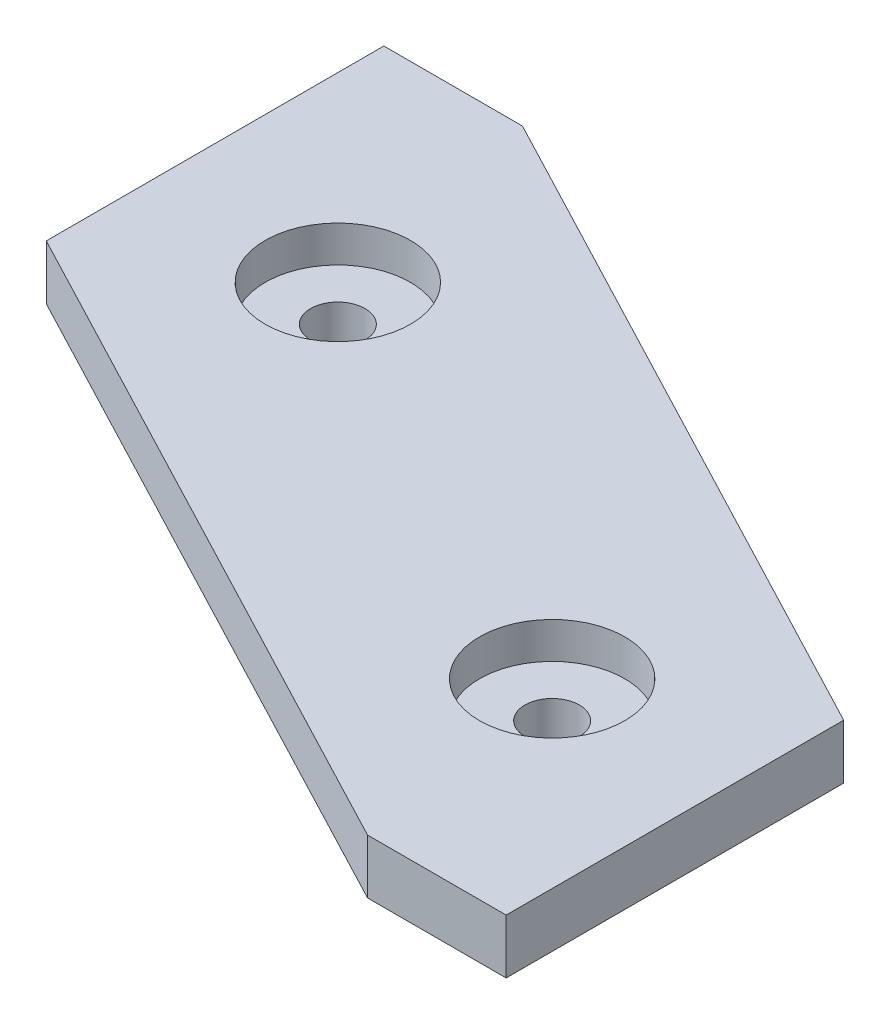
from build123d import *

# Parameters (mm, degrees)
BOSS_EXTRUDE1_DEPTH = 3
SKETCH1_R           = 6
BOSS_EXTRUDE3_DEPTH = 2
SKETCH4_R           = 1.5
CUT_EXTRUDE1_DEPTH  = 46.914811248
SKETCH5_R           = 4
CUT_EXTRUDE2_DEPTH  = 2
CUT_EXTRUDE3_DEPTH  = 46.914811248


with BuildPart() as part:
    # Sketch3 → Boss-Extrude1 (new body)
    with BuildSketch(Plane(origin=(0, 0, 0), x_dir=(1, 0, 0), z_dir=(0, 1, 0))):
        Polygon((-10, 16.53279569), (-10, -6.048583789), (34.799193535, -29.53279569), (34.799193535, -6.951416211), align=None)
    extrude(amount=BOSS_EXTRUDE1_DEPTH)

    # Sketch1 → Boss-Extrude3 (add)
    with BuildSketch(Plane(origin=(0, 0, 0), x_dir=(1, 0, 0), z_dir=(0, 1, 0))):
        with Locations(Location((0, 0, 0), (0, 0, 270))):
            Circle(SKETCH1_R)
        with Locations(Location((24.799193535, -13, 0), (0, 0, 270))):
            Circle(SKETCH1_R)
    extrude(amount=-BOSS_EXTRUDE3_DEPTH)

    # Sketch4 → Cut-Extrude1 (cut, through all)
    with BuildSketch(Plane(origin=(0, 3, 0), x_dir=(1, 0, 0), z_dir=(0, 1, 0))):
        with Locations(Location((0, 0, 0), (0, 0, 270))):
            Circle(SKETCH4_R)
        with Locations(Location((24.799193535, -13, 0), (0, 0, 270))):
            Circle(SKETCH4_R)
    extrude(amount=-CUT_EXTRUDE1_DEPTH, mode=Mode.SUBTRACT)

    # Sketch5 → Cut-Extrude2 (cut)
    with BuildSketch(Plane(origin=(0, 3, 0), x_dir=(1, 0, 0), z_dir=(0, 1, 0))):
        with Locations(Location((0, 0, 0), (0, 0, 270))):
            Circle(SKETCH5_R)
        with Locations(Location((24.799193535, -13, 0), (0, 0, 270))):
            Circle(SKETCH5_R)
    extrude(amount=-CUT_EXTRUDE2_DEPTH, mode=Mode.SUBTRACT)

    # Sketch7 → Cut-Extrude3 (cut, through all)
    with BuildSketch(Plane(origin=(0, 3, 0), x_dir=(1, 0, 0), z_dir=(0, 1, 0))):
        Polygon((-10, 16.53279569), (-10, 12.53279569), (-2.369478912, 12.53279569), align=None)
        Polygon((34.799193535, -29.53279569), (34.799193535, -25.53279569), (27.168672447, -25.53279569), align=None)
    extrude(amount=-CUT_EXTRUDE3_DEPTH, mode=Mode.SUBTRACT)


solid = part.part
